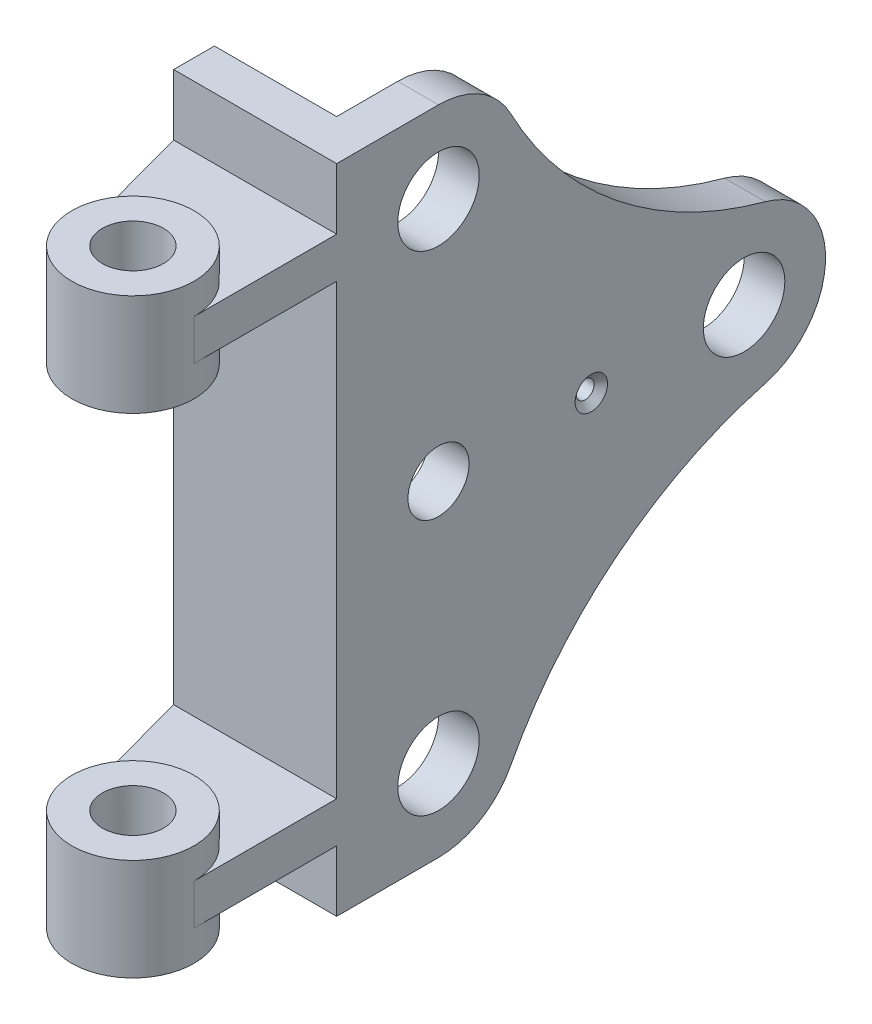
from build123d import *
from build123d.topology import SkipClean

# Parameters (mm, degrees)
BASE_EXTRUDE_DEPTH                                = 6.35
SKETCH4_R                                         = 6.35
SKETCH4_R_2                                       = 4.7625
CUT_EXTRUDE1_DEPTH                                = 128.158650905
SKETCH3_W                                         = 25.4
SKETCH3_H                                         = 101.6
BOSS_EXTRUDE1_DEPTH                               = 6.35
BOSS_EXTRUDE2_DEPTH                               = 3.175
SKETCH6_R                                         = 9.525
BOSS_EXTRUDE3_DEPTH                               = 7.9375
SKETCH7_R                                         = 4.7625
CUT_EXTRUDE2_DEPTH                                = 125.686983708
CSK_FOR_3_FLAT_HEAD_MACHINE_SCREW_100_D           = 2.794
CSK_FOR_3_FLAT_HEAD_MACHINE_SCREW_100_DEPTH       = 4.7625
CSK_FOR_3_FLAT_HEAD_MACHINE_SCREW_100_CSINK_D     = 5.0546
CSK_FOR_3_FLAT_HEAD_MACHINE_SCREW_100_CSINK_ANGLE = 100
CSK_FOR_3_FLAT_HEAD_MACHINE_SCREW_100_TIP         = 0.839402285


with BuildPart() as part:
    # Sketch2 → Base-Extrude (new body)
    with BuildSketch(Plane(origin=(0, 0, 0), x_dir=(0, 0, -1), z_dir=(1, 0, 0))):
        with BuildLine():
            Line((0, 0), (0, 101.6))
            Line((0, 101.6), (15.875, 101.6))
            ThreePointArc((15.875, 101.6), (22.439736017, 99.771717483), (27.114363043, 94.813266304))
            ThreePointArc((27.114363043, 94.813266304), (43.64304274, 74.794428425), (66.801863043, 63.063266304))
            ThreePointArc((66.801863043, 63.063266304), (76.2, 50.8), (66.801863043, 38.536733696))
            ThreePointArc((66.801863043, 38.536733696), (43.64304274, 26.805571575), (27.114363043, 6.786733696))
            ThreePointArc((27.114363043, 6.786733696), (22.439736017, 1.828282517), (15.875, 0))
            Line((15.875, 0), (0, 0))
        make_face()
    extrude(amount=BASE_EXTRUDE_DEPTH)

    # Sketch4 → Cut-Extrude1 (cut, through all)
    with BuildSketch(Plane(origin=(6.35, 0, 0), x_dir=(0, 0, -1), z_dir=(1, 0, 0))):
        with Locations((63.5, 50.8)):
            Circle(SKETCH4_R)
        with Locations((15.875, 88.9)):
            Circle(SKETCH4_R)
        with Locations((15.875, 12.7)):
            Circle(SKETCH4_R)
        with Locations((15.875, 50.8)):
            Circle(SKETCH4_R_2)
    extrude(amount=-CUT_EXTRUDE1_DEPTH, mode=Mode.SUBTRACT)

    # Sketch3 → Boss-Extrude1 (add)
    with BuildSketch(Plane.XY):
        with Locations((-6.35, 50.8)):
            Rectangle(SKETCH3_W, SKETCH3_H)
    extrude(amount=-BOSS_EXTRUDE1_DEPTH)

    # Sketch5 → Boss-Extrude2 (add, symmetric)
    with BuildSketch(Plane(origin=(0, 88.9, 0), x_dir=(-1, 0, 0), z_dir=(0, 1, 0))):
        with BuildLine():
            Line((19.05, 0), (-6.35, 0))
            Line((-6.35, 0), (-6.35, 22.225))
            ThreePointArc((-6.35, 22.225), (1.921253552, 31.667126076), (12.369946424, 24.710676017))
            Line((12.369946424, 24.710676017), (19.05, 0))
        make_face()
    boss_extrude2 = extrude(amount=BOSS_EXTRUDE2_DEPTH, both=True)

    # Sketch6 → Boss-Extrude3 (add, symmetric)
    with SkipClean():  # the faces are left unmerged after this step: merging them gives an invalid solid
        with BuildSketch(Plane(origin=(0, 88.9, 0), x_dir=(-1, 0, 0), z_dir=(0, 1, 0))):
            with Locations(Location((3.175, 22.225, 0), (0, 0, 90))):
                Circle(SKETCH6_R)
        boss_extrude3 = extrude(amount=BOSS_EXTRUDE3_DEPTH, both=True)

    # Sketch7 → Cut-Extrude2 (cut, through all)
    with SkipClean():  # the faces are left unmerged after this step: merging them gives an invalid solid
        with BuildSketch(Plane(origin=(0, 96.8375, 0), x_dir=(-1, 0, 0), z_dir=(0, 1, 0))):
            with Locations(Location((3.175, 22.225, 0), (0, 0, 90))):
                Circle(SKETCH7_R)
        cut_extrude2 = extrude(amount=-CUT_EXTRUDE2_DEPTH, mode=Mode.SUBTRACT)

    # Mirror2: Boss-Extrude2, Boss-Extrude3, Cut-Extrude2 across plane
    with SkipClean():  # the faces are left unmerged after this step: merging them gives an invalid solid
        add(boss_extrude2.mirror(Plane.ZX.offset(50.8)))
        add(boss_extrude3.mirror(Plane.ZX.offset(50.8)))
        add(cut_extrude2.mirror(Plane.ZX.offset(50.8)), mode=Mode.SUBTRACT)

    # CSK for #3 Flat Head Machine Screw (100)1
    with Locations(Plane(origin=(6.35, 0, 0), x_dir=(0, 0, -1), z_dir=(1, 0, 0))):
        with Locations((39.6875, 50.8)):
            CounterSinkHole(CSK_FOR_3_FLAT_HEAD_MACHINE_SCREW_100_D / 2, CSK_FOR_3_FLAT_HEAD_MACHINE_SCREW_100_CSINK_D / 2, depth=CSK_FOR_3_FLAT_HEAD_MACHINE_SCREW_100_DEPTH, counter_sink_angle=CSK_FOR_3_FLAT_HEAD_MACHINE_SCREW_100_CSINK_ANGLE)
            with Locations((0, 0, -(CSK_FOR_3_FLAT_HEAD_MACHINE_SCREW_100_DEPTH + CSK_FOR_3_FLAT_HEAD_MACHINE_SCREW_100_TIP / 2))):  # 118° drill point
                Cone(0, CSK_FOR_3_FLAT_HEAD_MACHINE_SCREW_100_D / 2, CSK_FOR_3_FLAT_HEAD_MACHINE_SCREW_100_TIP, mode=Mode.SUBTRACT)


solid = part.part
